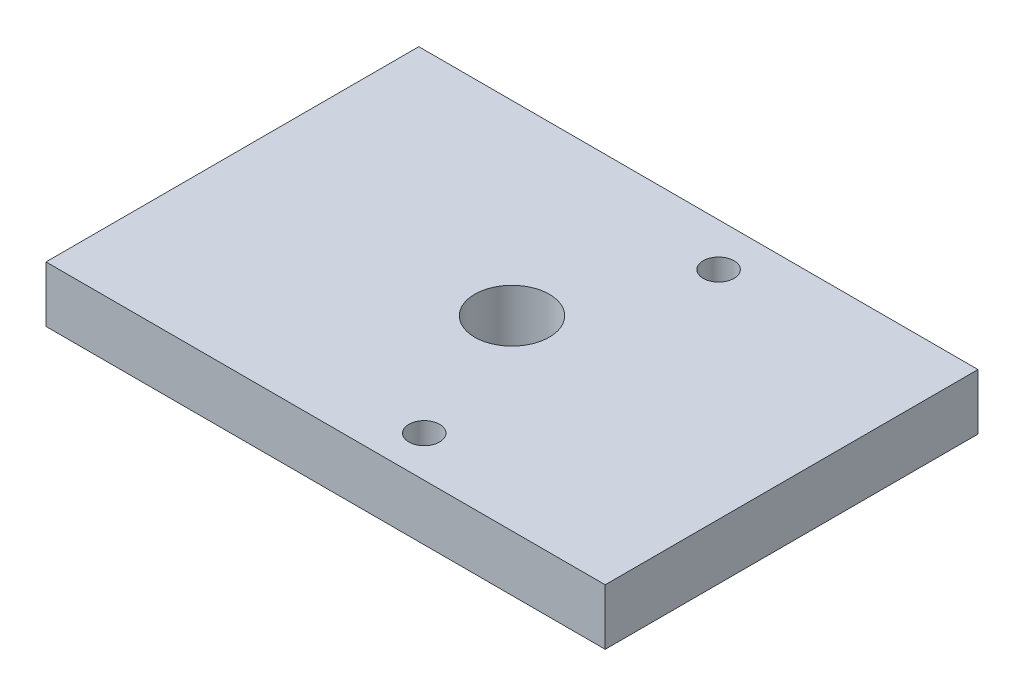
from build123d import *

# Parameters (mm, degrees)
SKETCH1_W           = 60
SKETCH1_H           = 40
SKETCH1_R           = 4
BOSS_EXTRUDE1_DEPTH = 6
SKETCH2_R           = 1.65
CUT_EXTRUDE1_DEPTH  = 10


with BuildPart() as part:
    # Sketch1 → Boss-Extrude1 (new body)
    with BuildSketch(Plane(origin=(0, 0, 0), x_dir=(1, 0, 0), z_dir=(0, 1, 0))):
        Rectangle(SKETCH1_W, SKETCH1_H)
        with Locations(Location((0, 0, 0), (0, 0, 270))):
            Circle(SKETCH1_R, mode=Mode.SUBTRACT)
    extrude(amount=BOSS_EXTRUDE1_DEPTH)

    # Sketch2 → Cut-Extrude1 (cut)
    with BuildSketch(Plane(origin=(0, 6, 0), x_dir=(1, 0, 0), z_dir=(0, 1, 0))):
        with Locations(Location((6.795088799, 15.372923216, 0), (0, 0, 270))):
            Circle(SKETCH2_R)
        with Locations(Location((6.202536092, -15.621413061, 0), (0, 0, 270))):
            Circle(SKETCH2_R)
    extrude(amount=-CUT_EXTRUDE1_DEPTH, mode=Mode.SUBTRACT)


solid = part.part
